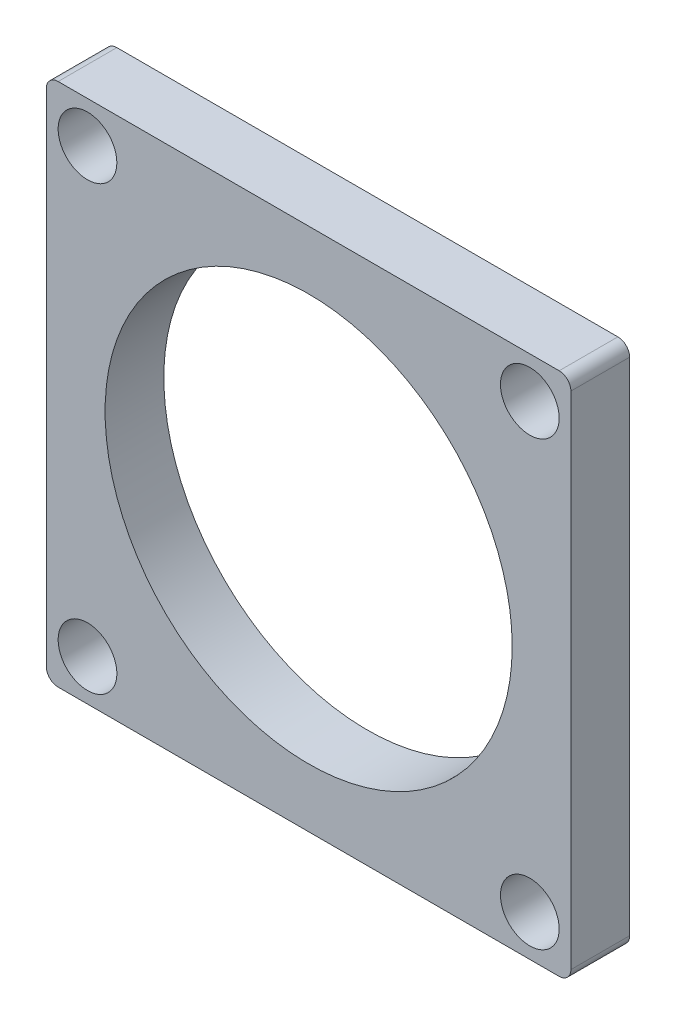
from build123d import *

# Parameters (mm, degrees)
CROQUIS1_W              = 89.34
CROQUIS1_H              = 89.34
SALIENTE_EXTRUIR2_DEPTH = 10
CROQUIS3_R              = 34.67
CORTAR_EXTRUIR2_DEPTH   = 10
CROQUIS4_R              = 5
CORTAR_EXTRUIR3_DEPTH   = 10
REDONDEO2_R             = 2


with BuildPart() as part:
    # Croquis1 → Saliente-Extruir2 (new body)
    with BuildSketch(Plane.XY):
        Rectangle(CROQUIS1_W, CROQUIS1_H)
    extrude(amount=SALIENTE_EXTRUIR2_DEPTH)

    # Croquis3 → Cortar-Extruir2 (cut)
    with BuildSketch(Plane.XY.offset(10)):
        Circle(CROQUIS3_R)
    extrude(amount=-CORTAR_EXTRUIR2_DEPTH, mode=Mode.SUBTRACT)

    # Croquis4 → Cortar-Extruir3 (cut)
    with BuildSketch(Plane.XY.offset(10)):
        with Locations((37.67, -37.67)):
            Circle(CROQUIS4_R)
        with Locations(Location((-37.67, -37.67, 0), (0, 0, 180))):
            Circle(CROQUIS4_R)
        with Locations((-37.67, 37.67)):
            Circle(CROQUIS4_R)
        with Locations(Location((37.67, 37.67, 0), (0, 0, 180))):
            Circle(CROQUIS4_R)
    extrude(amount=-CORTAR_EXTRUIR3_DEPTH, mode=Mode.SUBTRACT)

    # Redondeo2
    redondeo2_edges = [part.edges().sort_by_distance(p)[0] for p in [
        (-44.67, -44.67, 5),
        (-44.67, 44.67, 5),
        (44.67, 44.67, 5),
        (44.67, -44.67, 5),
    ]]
    fillet(redondeo2_edges, radius=REDONDEO2_R)


solid = part.part
